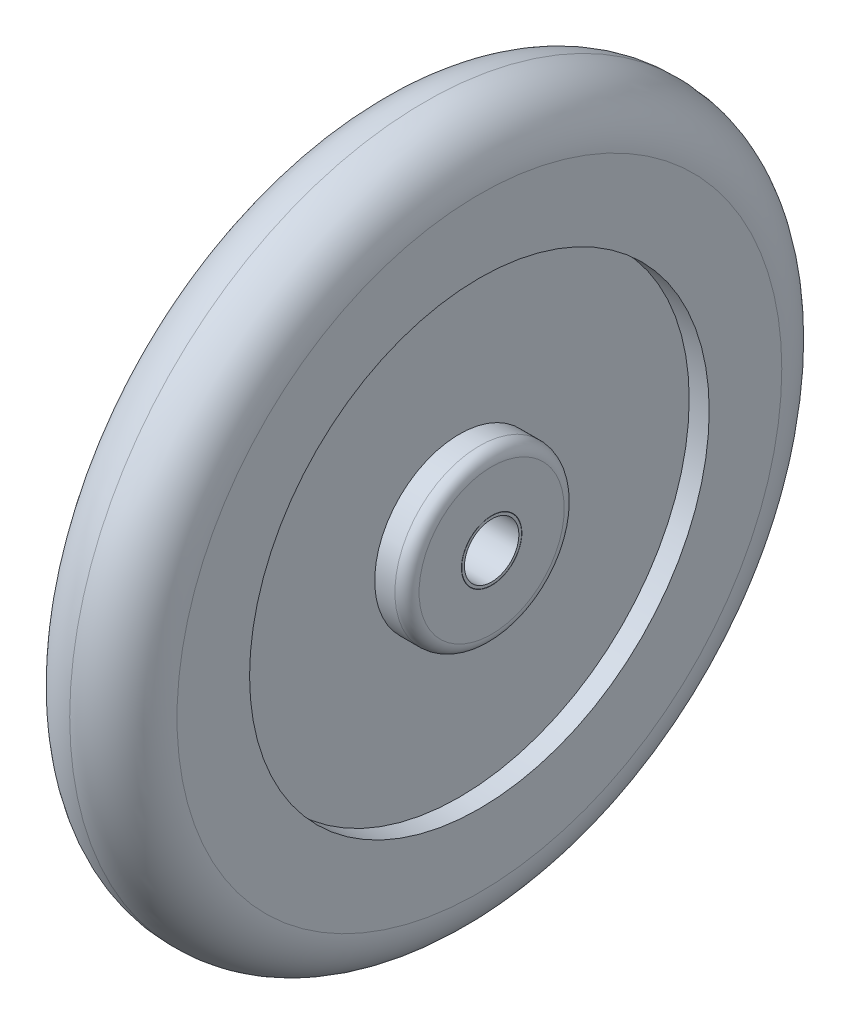
from build123d import *

# Parameters (mm, degrees)
SKETCH3_R          = 5
SKETCH3_R_2        = 4.95
SKETCH3_R_3        = 4.5
CUT_EXTRUDE1_DEPTH = 86.951980751
FILLET1_R          = 1
FILLET2_R          = 0.2


with BuildPart() as part:
    # Sketch2 → Revolve1 (revolve)
    with BuildSketch(Plane.XY, mode=Mode.PRIVATE) as revolve1_sk:
        with BuildLine():
            Line((-11.027307991, 12), (-11.027307991, 0))
            Line((-11.027307991, 0), (0, 0))
            Line((0, 0), (0, 58.738594233))
            ThreePointArc((0, 58.738594233), (-6.347653376, 56.272221081), (-9, 50))
            Line((-9, 50), (-9, 38))
            Line((-9, 38), (-5.692350932, 38))
            Line((-5.692350932, 38), (-5.692350932, 35.792500491))
            Line((-5.692350932, 35.792500491), (-5.692350932, 14))
            Line((-5.692350932, 14), (-9.027307991, 14))
            ThreePointArc((-9.027307991, 14), (-10.441521553, 13.414213562), (-11.027307991, 12))
        make_face()
        with BuildLine():
            Line((0, 58.738594233), (0, 0))
            Line((0, 0), (11.027307991, 0))
            Line((11.027307991, 0), (11.027307991, 12))
            ThreePointArc((11.027307991, 12), (10.441521553, 13.414213562), (9.027307991, 14))
            Line((9.027307991, 14), (5.692350932, 14))
            Line((5.692350932, 14), (5.692350932, 35.792500491))
            Line((5.692350932, 35.792500491), (5.692350932, 38))
            Line((5.692350932, 38), (9, 38))
            Line((9, 38), (9, 50))
            ThreePointArc((9, 50), (6.347653376, 56.272221081), (0, 58.738594233))
        make_face()
    revolve(revolve1_sk.sketch.rotate(Axis((0, 0, 0), (-1, 0, 0)), 90), axis=Axis((0, 0, 0), (-1, 0, 0)))

    # Sketch3 → Cut-Extrude1 (cut, through all)
    # profile 1 of 2: a face of its own
    with BuildSketch(Plane(origin=(11.027307991, 0, 0), x_dir=(0, 0, -1), z_dir=(1, 0, 0))):
        Circle(SKETCH3_R)
        Circle(SKETCH3_R_2, mode=Mode.SUBTRACT)
    # profile 2 of 2: a face of its own
    with BuildSketch(Plane(origin=(11.027307991, 0, 0), x_dir=(0, 0, -1), z_dir=(1, 0, 0))):
        Circle(SKETCH3_R_3)
    extrude(amount=-CUT_EXTRUDE1_DEPTH, mode=Mode.SUBTRACT)


with BuildPart() as cut_extrude1_piece_1:
    # of the separate pieces the step leaves, piece 1, a body of its own (cut_extrude1_pieces)
    add(part.part.solids().sort_by_distance((-11.027307991, 0, -12))[0])

    # Fillet1
    fillet1_edges = [cut_extrude1_piece_1.edges().sort_by_distance(p)[0] for p in [
        (-5.692350932, 0, 38),
    ]]
    fillet(fillet1_edges, radius=FILLET1_R)

    # Fillet2
    fillet2_edges = [cut_extrude1_piece_1.edges().sort_by_distance(p)[0] for p in [
        (-9, 0, 38),
    ]]
    fillet(fillet2_edges, radius=FILLET2_R)


with BuildPart() as cut_extrude1_piece_2:
    # of the separate pieces the step leaves, piece 2, a body of its own (cut_extrude1_pieces)
    add(part.part.solids().sort_by_distance((-11.027307991, 0, -4.95))[0])


solid = Compound([cut_extrude1_piece_1.part, cut_extrude1_piece_2.part])
